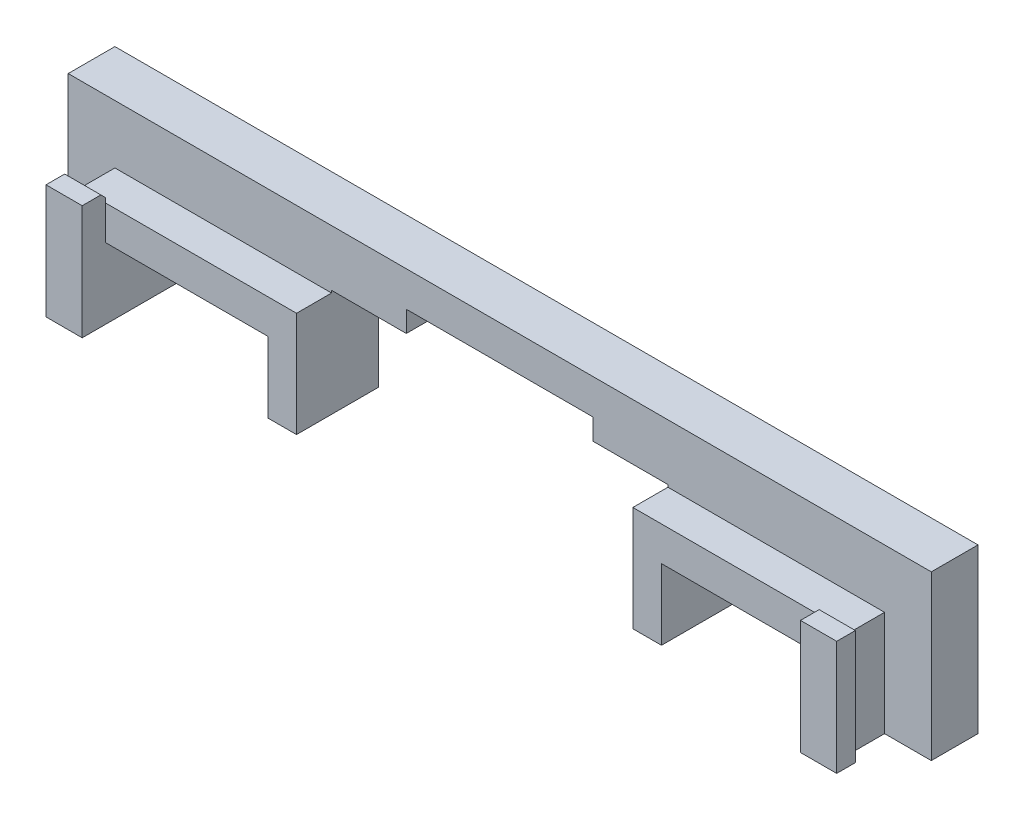
from build123d import *

# Parameters (mm, degrees)
BOSS_EXTRUDE1_DEPTH = 2
BOSS_EXTRUDE2_DEPTH = 1.5
SKETCH4_W           = 1.550075991
SKETCH4_H           = 4.899134607
BOSS_EXTRUDE3_DEPTH = 1
CHAMFER1_SIZE       = 0.2
CUT_EXTRUDE1_START  = -2
SKETCH5_W           = 3.300200616
SKETCH5_H           = 1
SKETCH5_W_2         = 3.300200617
CUT_EXTRUDE1_DEPTH  = 2
SKETCH6_W           = 2
SKETCH6_H           = 6.999134607
BOSS_EXTRUDE4_DEPTH = 2


with BuildPart() as part:
    # Sketch2 → Boss-Extrude1 (new body)
    with BuildSketch(Plane.XY):
        Polygon((285.431409328, 90.45473243), (277.431409328, 90.45473243), (277.431409328, 89.55473243), (274.231409328, 89.55473243), (274.231409328, 84.955597823), (273.006316619, 84.955597823), (273.006316619, 87.985794184), (266.055906266, 87.985794184), (266.055906266, 84.955597823), (264.955830275, 84.955597823), (264.955830275, 91.95473243), (297.906988381, 91.95473243), (297.906988381, 84.955597823), (296.80691239, 84.955597823), (296.80691239, 87.985794184), (289.856502038, 87.985794184), (289.856502038, 84.955597823), (288.631409328, 84.955597823), (288.631409328, 89.55473243), (285.431409328, 89.55473243), align=None)
    extrude(amount=-BOSS_EXTRUDE1_DEPTH)

    # Sketch3 → Boss-Extrude2 (add)
    with BuildSketch(Plane.XY):
        Polygon((274.231409328, 89.45473243), (264.955830275, 89.45473243), (264.955830275, 84.955597823), (266.055906266, 84.955597823), (266.055906266, 87.985794184), (273.006316619, 87.985794184), (273.006316619, 84.955597823), (274.231409328, 84.955597823), align=None)
        Polygon((297.906988381, 89.45473243), (288.631409328, 89.45473243), (288.631409328, 84.955597823), (289.856502038, 84.955597823), (289.856502038, 87.985794184), (296.80691239, 87.985794184), (296.80691239, 84.955597823), (297.906988381, 84.955597823), align=None)
    extrude(amount=BOSS_EXTRUDE2_DEPTH)

    # Sketch4 → Boss-Extrude3 (add)
    with BuildSketch(Plane.XY.offset(1.5)):
        with Locations((265.280868271, 87.405165127)):
            Rectangle(SKETCH4_W, SKETCH4_H)
        with Locations((297.581950386, 87.405165127)):
            Rectangle(SKETCH4_W, SKETCH4_H)
    extrude(amount=BOSS_EXTRUDE3_DEPTH)

    # Chamfer1
    chamfer1_edges = [part.edges().sort_by_distance(p)[0] for p in [
        (264.505830275, 87.405165127, 1.5),
        (265.280868271, 89.85473243, 1.5),
        (298.356988381, 87.405165127, 1.5),
        (297.581950386, 89.85473243, 1.5),
    ]]
    chamfer(chamfer1_edges, length=CHAMFER1_SIZE)

    # Sketch5 → Cut-Extrude1 (cut)
    with BuildSketch(Plane(origin=(0, 0, -2), x_dir=(-1, 0, 0), z_dir=(0, 0, -1)).offset(CUT_EXTRUDE1_START)):
        with Locations((-269.530111382, 88.485794184)):
            Rectangle(SKETCH5_W, SKETCH5_H)
        with Locations((-293.332707275, 88.485794184)):
            Rectangle(SKETCH5_W_2, SKETCH5_H)
    extrude(amount=CUT_EXTRUDE1_DEPTH, mode=Mode.SUBTRACT)

    # Sketch6 → Boss-Extrude4 (add)
    with BuildSketch(Plane(origin=(0, 0, -2), x_dir=(-1, 0, 0), z_dir=(0, 0, -1))):
        with Locations((-298.906988381, 88.455165127)):
            Rectangle(SKETCH6_W, SKETCH6_H)
        with Locations((-263.955830275, 88.455165127)):
            Rectangle(SKETCH6_W, SKETCH6_H)
    extrude(amount=-BOSS_EXTRUDE4_DEPTH)


solid = part.part
